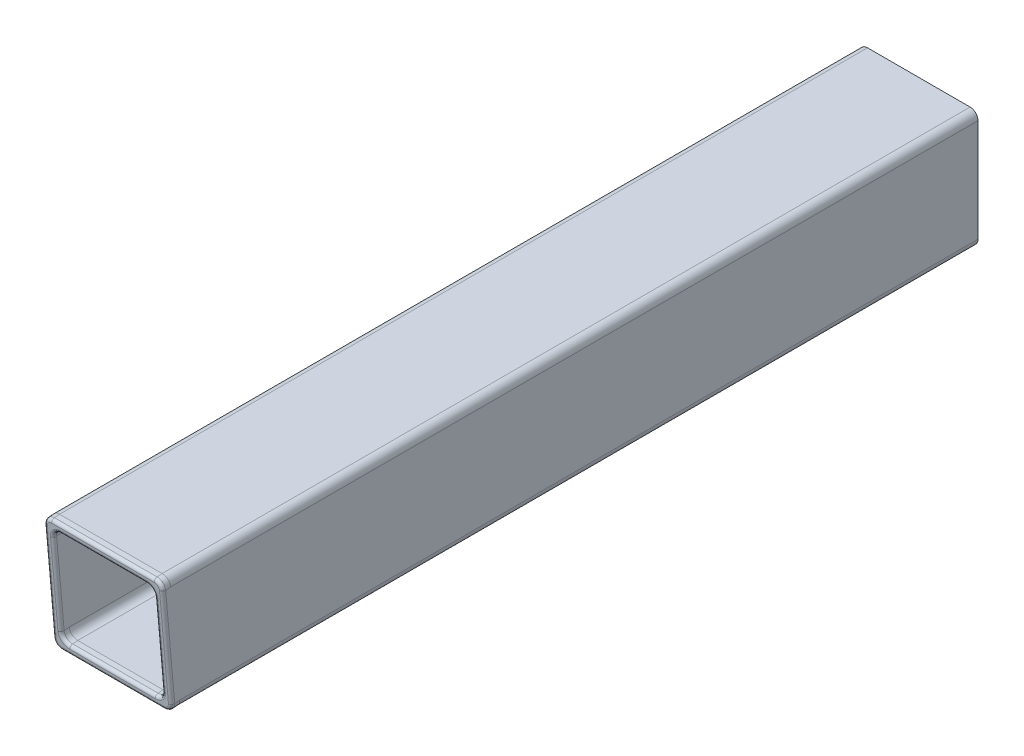
from build123d import *

# Parameters (mm, degrees)
BOSS_EXTRUDE1_DEPTH = 260
CUT_EXTRUDE1_DEPTH  = 266.524424489
BOSS_EXTRUDE2_DEPTH = 2.624382921
FILLET1_R           = 1


with BuildPart() as part:
    # Sketch1 → Boss-Extrude1 (new body)
    with BuildSketch(Plane.XY):
        with BuildLine():
            Line((2.54, 0), (35.56, 0))
            ThreePointArc((35.56, 0), (37.356051224, -0.743948776), (38.1, -2.54))
            Line((38.1, -2.54), (38.1, -35.56))
            ThreePointArc((38.1, -35.56), (37.356051224, -37.356051224), (35.56, -38.1))
            Line((35.56, -38.1), (2.54, -38.1))
            ThreePointArc((2.54, -38.1), (0.743948776, -37.356051224), (0, -35.56))
            Line((0, -35.56), (0, -2.54))
            ThreePointArc((0, -2.54), (0.743948776, -0.743948776), (2.54, 0))
        make_face()
        with BuildLine():
            Line((5.3086, -2.7686), (32.7914, -2.7686))
            ThreePointArc((32.7914, -2.7686), (34.587451224, -3.512548776), (35.3314, -5.3086))
            Line((35.3314, -5.3086), (35.3314, -32.7914))
            ThreePointArc((35.3314, -32.7914), (34.587451224, -34.587451224), (32.7914, -35.3314))
            Line((32.7914, -35.3314), (5.3086, -35.3314))
            ThreePointArc((5.3086, -35.3314), (3.512548776, -34.587451224), (2.7686, -32.7914))
            Line((2.7686, -32.7914), (2.7686, -5.3086))
            ThreePointArc((2.7686, -5.3086), (3.512548776, -3.512548776), (5.3086, -2.7686))
        make_face(mode=Mode.SUBTRACT)
    extrude(amount=BOSS_EXTRUDE1_DEPTH)

    # Sketch2 → Cut-Extrude1 (cut, through all)
    with BuildSketch(Plane(origin=(38.1, 0, 0), x_dir=(0, 0, -1), z_dir=(1, 0, 0))):
        Polygon((-260, 0), (-256.66668192, -38.1), (-260, -38.1), align=None)
    extrude(amount=-CUT_EXTRUDE1_DEPTH, mode=Mode.SUBTRACT)

    # Sketch3 → Boss-Extrude2 (add)
    with BuildSketch(Plane(origin=(0, -22.574263097, 258.025007892), x_dir=(1, 0, 0), z_dir=(0, -0.08715574274765835, 0.9961946980917457))):
        with BuildLine():
            Line((2.54, -15.585042696), (35.56, -15.585042696))
            add(Edge.make_bspline(
                [(35.56, -15.585042696), (38.1, -15.585042696), (38.1, -13.035340309)],
                knots=[0, 0, 0, 1.570796327, 1.570796327, 1.570796327], degree=2, weights=[1, 0.707106781, 1]))
            Line((38.1, -13.035340309), (38.1, 20.110790727))
            add(Edge.make_bspline(
                [(38.1, 20.110790727), (38.1, 22.660493114), (35.56, 22.660493114)],
                knots=[1.570796327, 1.570796327, 1.570796327, 3.141592654, 3.141592654, 3.141592654], degree=2, weights=[1, 0.707106781, 1]))
            Line((35.56, 22.660493114), (2.54, 22.660493114))
            add(Edge.make_bspline(
                [(2.54, 22.660493114), (0, 22.660493114), (0, 20.110790727)],
                knots=[3.141592654, 3.141592654, 3.141592654, 4.71238898, 4.71238898, 4.71238898], degree=2, weights=[1, 0.707106781, 1]))
            Line((0, 20.110790727), (0, -13.035340309))
            add(Edge.make_bspline(
                [(0, -13.035340309), (0, -15.585042696), (2.54, -15.585042696)],
                knots=[4.71238898, 4.71238898, 4.71238898, 6.283185307, 6.283185307, 6.283185307], degree=2, weights=[1, 0.707106781, 1]))
        make_face()
        with BuildLine():
            Line((35.3314, 17.331615125), (35.3314, -10.256164706))
            add(Edge.make_bspline(
                [(32.7914, -12.805867094), (35.3314, -12.805867094), (35.3314, -10.256164706)],
                knots=[0, 0, 0, 1.570796327, 1.570796327, 1.570796327], degree=2, weights=[1, 0.707106781, 1]))
            Line((32.7914, -12.805867094), (5.3086, -12.805867094))
            add(Edge.make_bspline(
                [(2.7686, -10.256164706), (2.7686, -12.805867094), (5.3086, -12.805867094)],
                knots=[4.71238898, 4.71238898, 4.71238898, 6.283185307, 6.283185307, 6.283185307], degree=2, weights=[1, 0.707106781, 1]))
            Line((2.7686, -10.256164706), (2.7686, 17.331615125))
            add(Edge.make_bspline(
                [(5.3086, 19.881317512), (2.7686, 19.881317512), (2.7686, 17.331615125)],
                knots=[3.141592654, 3.141592654, 3.141592654, 4.71238898, 4.71238898, 4.71238898], degree=2, weights=[1, 0.707106781, 1]))
            Line((5.3086, 19.881317512), (32.7914, 19.881317512))
            add(Edge.make_bspline(
                [(35.3314, 17.331615125), (35.3314, 19.881317512), (32.7914, 19.881317512)],
                knots=[1.570796327, 1.570796327, 1.570796327, 3.141592654, 3.141592654, 3.141592654], degree=2, weights=[1, 0.707106781, 1]))
        make_face(mode=Mode.SUBTRACT)
    extrude(amount=BOSS_EXTRUDE2_DEPTH)

    # Fillet1
    fillet1_edges = [part.edges().sort_by_distance(p)[0] for p in [
        (35.3314, -19.278730043, 260.947737311),
        (34.589162497, -34.814468363, 259.588536329),
        (19.05, -35.560130043, 259.523299385),
        (3.510837922, -34.814468782, 259.588536292),
        (2.7686, -19.278730043, 260.947737311),
        (3.510837503, -3.742991723, 262.306938294),
        (19.05, -2.997330043, 262.372175238),
        (34.589162078, -3.742991304, 262.306938331),
        (0, -19.278730043, 260.947737311),
        (0.742237922, -37.583068782, 259.346315178),
        (19.05, -38.328730043, 259.281078271),
        (37.357762497, -37.583068363, 259.346315215),
        (38.1, -19.278730043, 260.947737311),
        (37.357762078, -0.974391304, 262.549159445),
        (19.05, -0.228730043, 262.614396352),
        (0.742237503, -0.974391723, 262.549159408),
    ]]
    fillet(fillet1_edges, radius=FILLET1_R)


solid = part.part
